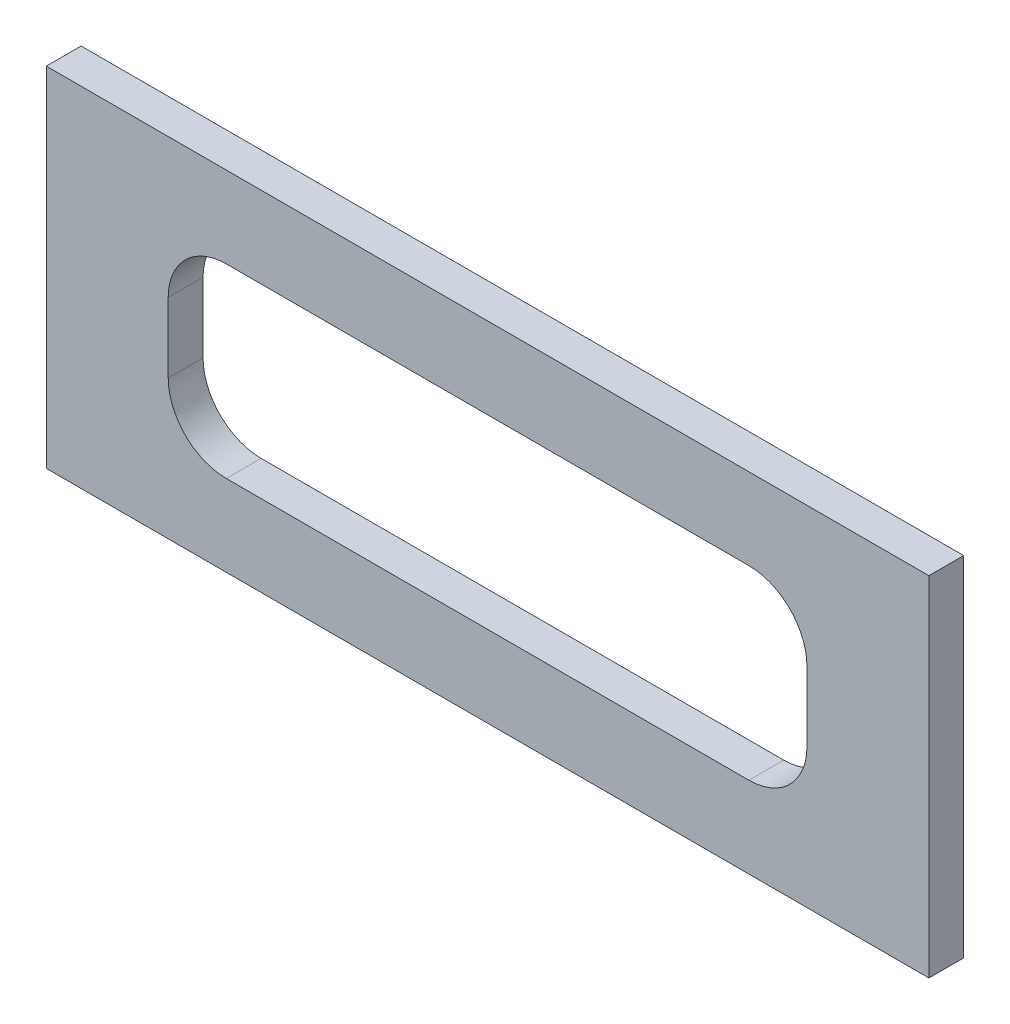
from build123d import *

# Parameters (mm, degrees)
ESBO_O1_W                = 152
ESBO_O1_H                = 60
RESSALTO_EXTRUS_O2_DEPTH = 6


with BuildPart() as part:
    # Esboço1 → Ressalto-extrusão2 (new body)
    with BuildSketch(Plane.XY):
        Rectangle(ESBO_O1_W, ESBO_O1_H)
        with BuildLine():
            Line((45, -16), (-45, -16))
            ThreePointArc((-45, -16), (-52.071067812, -13.071067812), (-55, -6))
            Line((-55, -6), (-55, 6))
            ThreePointArc((-55, 6), (-52.071067812, 13.071067812), (-45, 16))
            Line((-45, 16), (45, 16))
            ThreePointArc((45, 16), (52.071067812, 13.071067812), (55, 6))
            Line((55, 6), (55, -6))
            ThreePointArc((55, -6), (52.071067812, -13.071067812), (45, -16))
        make_face(mode=Mode.SUBTRACT)
    extrude(amount=RESSALTO_EXTRUS_O2_DEPTH)


solid = part.part
